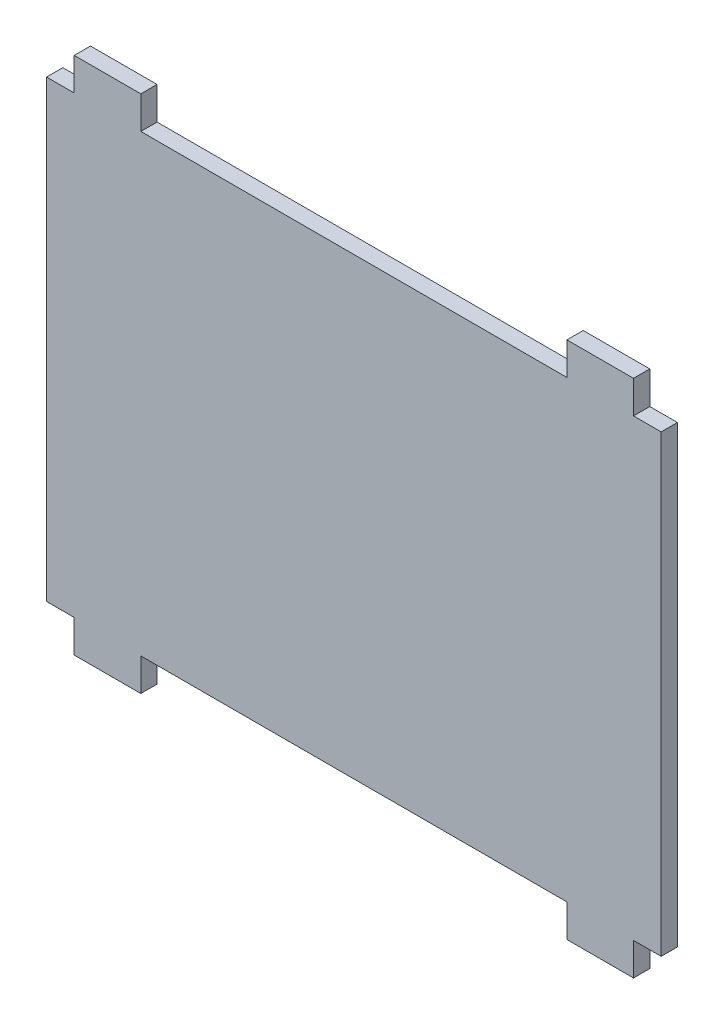
from build123d import *

# Parameters (mm, degrees)
SKETCH1_W           = 60
SKETCH1_H           = 25.35
BOSS_EXTRUDE1_DEPTH = 1.5875
SKETCH2_W           = 41.6
SKETCH2_H           = 3.18
SKETCH2_W_2         = 5.4
CUT_EXTRUDE1_DEPTH  = 1.5875


with BuildPart() as part:
    # Sketch1 → Boss-Extrude1 (new body)
    with BuildSketch(Plane.XY):
        with Locations((0, 12.675)):
            Rectangle(SKETCH1_W, SKETCH1_H)
    boss_extrude1 = extrude(amount=BOSS_EXTRUDE1_DEPTH)

    # Sketch2 → Cut-Extrude1 (cut)
    with BuildSketch(Plane.XY.offset(1.5875)):
        with Locations((0, 23.76)):
            Rectangle(SKETCH2_W, SKETCH2_H)
        with Locations((30, 23.76)):
            Rectangle(SKETCH2_W_2, SKETCH2_H)
        with Locations((-30, 23.76)):
            Rectangle(SKETCH2_W_2, SKETCH2_H)
    cut_extrude1 = extrude(amount=-CUT_EXTRUDE1_DEPTH, mode=Mode.SUBTRACT)

    # Mirror1: Boss-Extrude1, Cut-Extrude1 across plane
    add(boss_extrude1.mirror(Plane.ZX))
    add(cut_extrude1.mirror(Plane.ZX), mode=Mode.SUBTRACT)


solid = part.part
